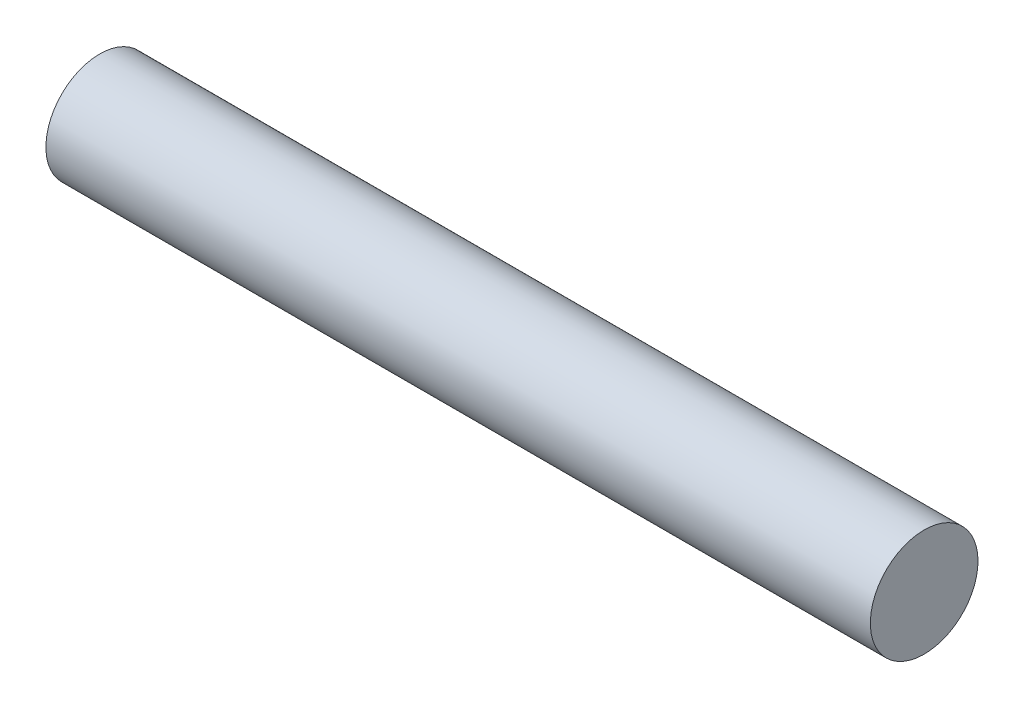
from build123d import *

# Parameters (mm, degrees)
SKETCH1_R           = 49.022
BOSS_EXTRUDE1_DEPTH = 751


with BuildPart() as part:
    # Sketch1 → Boss-Extrude1 (new body)
    with BuildSketch(Plane(origin=(0, 0, 0), x_dir=(0, 0, -1), z_dir=(1, 0, 0))):
        Circle(SKETCH1_R)
    extrude(amount=BOSS_EXTRUDE1_DEPTH)


solid = part.part
